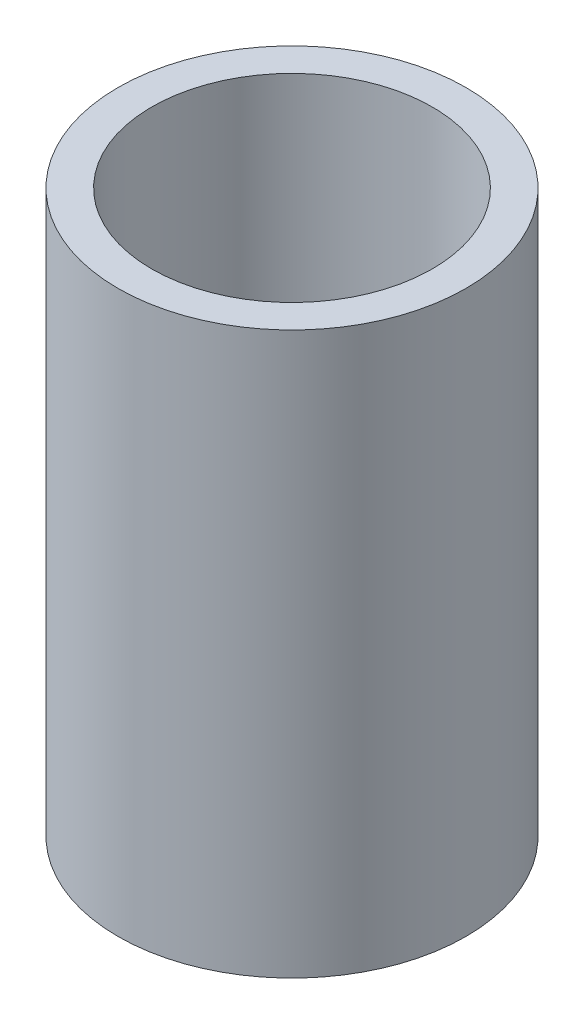
from build123d import *

# Parameters (mm, degrees)
SKETCH1_R           = 15.748
SKETCH1_R_2         = 12.7
BOSS_EXTRUDE1_DEPTH = 50.8


with BuildPart() as part:
    # Sketch1 → Boss-Extrude1 (new body)
    with BuildSketch(Plane(origin=(0, 0, 0), x_dir=(1, 0, 0), z_dir=(0, 1, 0))):
        with Locations(Location((0, 0, 0), (0, 0, 270))):
            Circle(SKETCH1_R)
        with Locations(Location((0, 0, 0), (0, 0, 270))):
            Circle(SKETCH1_R_2, mode=Mode.SUBTRACT)
    extrude(amount=BOSS_EXTRUDE1_DEPTH)


solid = part.part
